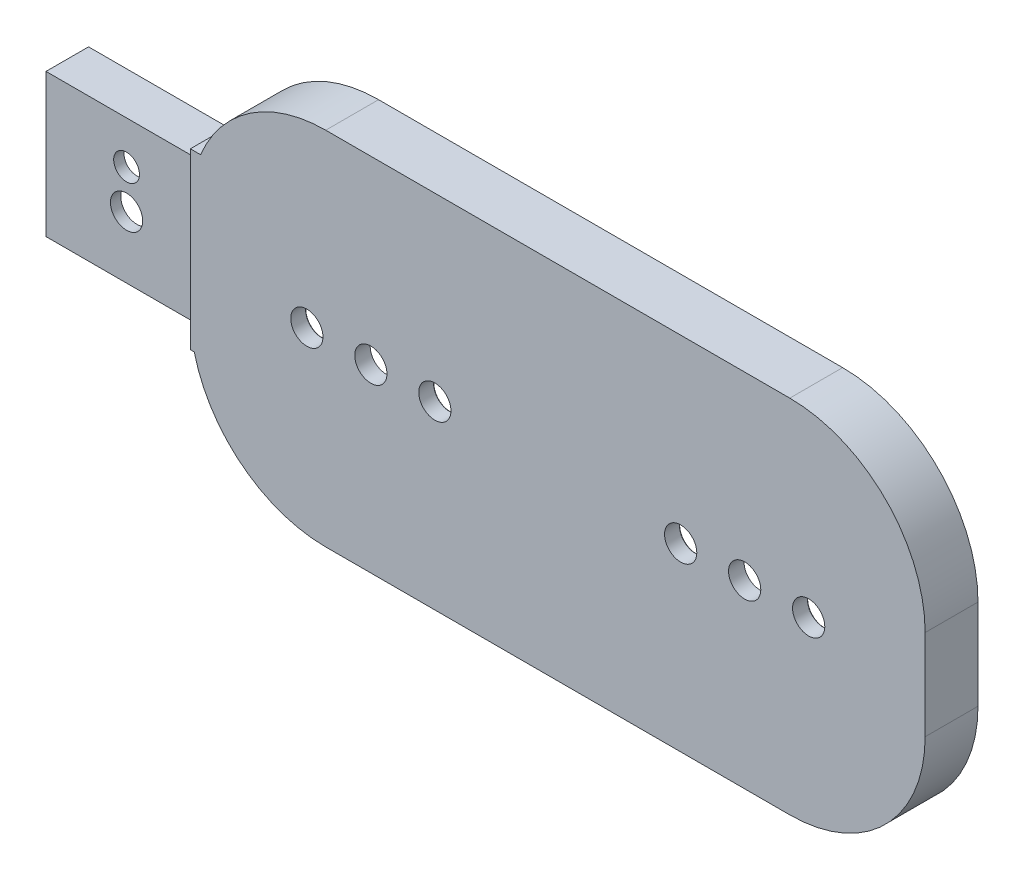
from build123d import *

# Parameters (mm, degrees)
SKETCH_1_W          = 114
SKETCH_1_H          = 56
SKETCH_1_W_2        = 110
SKETCH_1_H_2        = 52
EXTRUDE_1_DEPTH     = 7
SKETCH_2_W          = 114
SKETCH_2_H          = 56
EXTRUDE_1_2_DEPTH   = 1.2
SKETCH_3_R          = 2.5
CUT_EXTRUDE_1_DEPTH = 1.2
FILLET_1_R          = 20
FILLET_2_R          = 21
SKETCH_4_W          = 33.86
SKETCH_4_H          = 14
EXTRUDE_2_DEPTH     = 1.2
SKETCH_5_R          = 2.5
CUT_EXTRUDE_2_DEPTH = 1.2
FILLET_3_R          = 0.1
SKETCH_14_W         = 26
SKETCH_14_H         = 22.2
EXTRUDE_5_DEPTH     = 7
SKETCH_15_W         = 28
SKETCH_15_H         = 18.2
CUT_EXTRUDE_3_DEPTH = 5
SKETCH_18_W         = 2
SKETCH_18_H         = 27
EXTRUDE_6_DEPTH     = 8.2
SKETCH_19_W         = 2
SKETCH_19_H         = 18.2
CUT_EXTRUDE_4_DEPTH = 5
SKETCH_20_R         = 2.5
SKETCH_20_R_2       = 2
CUT_EXTRUDE_5_DEPTH = 5
SKETCH_21_W         = 24
SKETCH_21_H         = 22.2
CUT_EXTRUDE_6_DEPTH = 0.4


with BuildPart() as part:
    # Эскиз1 → Extrude 1 (new body)
    with BuildSketch(Plane.XY):
        Rectangle(SKETCH_1_W, SKETCH_1_H)
        Rectangle(SKETCH_1_W_2, SKETCH_1_H_2, mode=Mode.SUBTRACT)
    extrude(amount=EXTRUDE_1_DEPTH)

    # Эскиз2 → Extrude 1 2 (add)
    with BuildSketch(Plane.XY.offset(7)):
        Rectangle(SKETCH_2_W, SKETCH_2_H)
    extrude(amount=EXTRUDE_1_2_DEPTH)

    # Эскиз3 → Вырез-Вытянуть1 (cut)
    with BuildSketch(Plane.XY.offset(8.2)):
        with Locations((-38.93, 0)):
            Circle(SKETCH_3_R)
        with Locations((-29, 0)):
            Circle(SKETCH_3_R)
        with Locations((-19.07, 0)):
            Circle(SKETCH_3_R)
        with Locations((19.07, 0)):
            Circle(SKETCH_3_R)
        with Locations((29, 0)):
            Circle(SKETCH_3_R)
        with Locations((38.93, 0)):
            Circle(SKETCH_3_R)
    extrude(amount=-CUT_EXTRUDE_1_DEPTH, mode=Mode.SUBTRACT)

    # Скругление1
    fillet_1_edges = [part.edges().sort_by_distance(p)[0] for p in [
        (-55, 26, 3.5),
        (-55, -26, 3.5),
        (55, -26, 3.5),
        (55, 26, 3.5),
    ]]
    fillet(fillet_1_edges, radius=FILLET_1_R)

    # Скругление2
    fillet_2_edges = [part.edges().sort_by_distance(p)[0] for p in [
        (-57, 28, 4.1),
        (57, 28, 4.1),
        (57, -28, 4.1),
        (-57, -28, 4.1),
    ]]
    fillet(fillet_2_edges, radius=FILLET_2_R)

    # Эскиз4 → Бобышка-Вытянуть2 (add)
    with BuildSketch(Plane(origin=(0, 0, 7), x_dir=(-1, 0, 0), z_dir=(0, 0, -1))):
        with Locations((29, 0)):
            Rectangle(SKETCH_4_W, SKETCH_4_H)
        with Locations((-29, 0)):
            Rectangle(SKETCH_4_W, SKETCH_4_H)
    extrude(amount=EXTRUDE_2_DEPTH)

    # Эскиз5 → Вырез-Вытянуть2 (cut)
    with BuildSketch(Plane.XY.offset(7)):
        with Locations((-29, 0)):
            Circle(SKETCH_5_R)
        with Locations((-38.93, 0)):
            Circle(SKETCH_5_R)
        with Locations((-19.07, 0)):
            Circle(SKETCH_5_R)
        with Locations((19.07, 0)):
            Circle(SKETCH_5_R)
        with Locations((29, 0)):
            Circle(SKETCH_5_R)
        with Locations((38.93, 0)):
            Circle(SKETCH_5_R)
    extrude(amount=-CUT_EXTRUDE_2_DEPTH, mode=Mode.SUBTRACT)

    # Скругление3
    fillet_3_edges = [part.edges().sort_by_distance(p)[0] for p in [
        (36.43, 0, 5.8),
        (16.57, 0, 5.8),
        (-21.57, 0, 5.8),
        (-41.43, 0, 5.8),
    ]]
    fillet(fillet_3_edges, radius=FILLET_3_R)

    # Эскиз14 → Бобышка-Вытянуть5 (add)
    with BuildSketch(Plane(origin=(0, 0, 7), x_dir=(-1, 0, 0), z_dir=(0, 0, -1))):
        with Locations((68, 1.5)):
            Rectangle(SKETCH_14_W, SKETCH_14_H)
    extrude(amount=EXTRUDE_5_DEPTH)

    # Эскиз15 → Вырез-Вытянуть3 (cut)
    with BuildSketch(Plane(origin=(0, 0, 0), x_dir=(-1, 0, 0), z_dir=(0, 0, -1))):
        with Locations((67, 1.5)):
            Rectangle(SKETCH_15_W, SKETCH_15_H)
    extrude(amount=-CUT_EXTRUDE_3_DEPTH, mode=Mode.SUBTRACT)

    # Эскиз18 → Бобышка-Вытянуть6 (add)
    with BuildSketch(Plane.XY.offset(8.2)):
        with Locations((-56, 1.5)):
            Rectangle(SKETCH_18_W, SKETCH_18_H)
    extrude(amount=-EXTRUDE_6_DEPTH)

    # Эскиз19 → Вырез-Вытянуть4 (cut)
    with BuildSketch(Plane(origin=(0, 0, 0), x_dir=(-1, 0, 0), z_dir=(0, 0, -1))):
        with Locations((56, 1.5)):
            Rectangle(SKETCH_19_W, SKETCH_19_H)
    extrude(amount=-CUT_EXTRUDE_4_DEPTH, mode=Mode.SUBTRACT)

    # Эскиз20 → Вырез-Вытянуть5 (cut)
    with BuildSketch(Plane(origin=(0, 0, 5), x_dir=(-1, 0, 0), z_dir=(0, 0, -1))):
        with Locations((68.5, 0)):
            Circle(SKETCH_20_R)
        with Locations((68.5, 6)):
            Circle(SKETCH_20_R_2)
    extrude(amount=-CUT_EXTRUDE_5_DEPTH, mode=Mode.SUBTRACT)

    # Эскиз21 → Вырез-Вытянуть6 (cut)
    with BuildSketch(Plane.XY.offset(7)):
        with Locations((-69, 1.5)):
            Rectangle(SKETCH_21_W, SKETCH_21_H)
    extrude(amount=-CUT_EXTRUDE_6_DEPTH, mode=Mode.SUBTRACT)


solid = part.part
